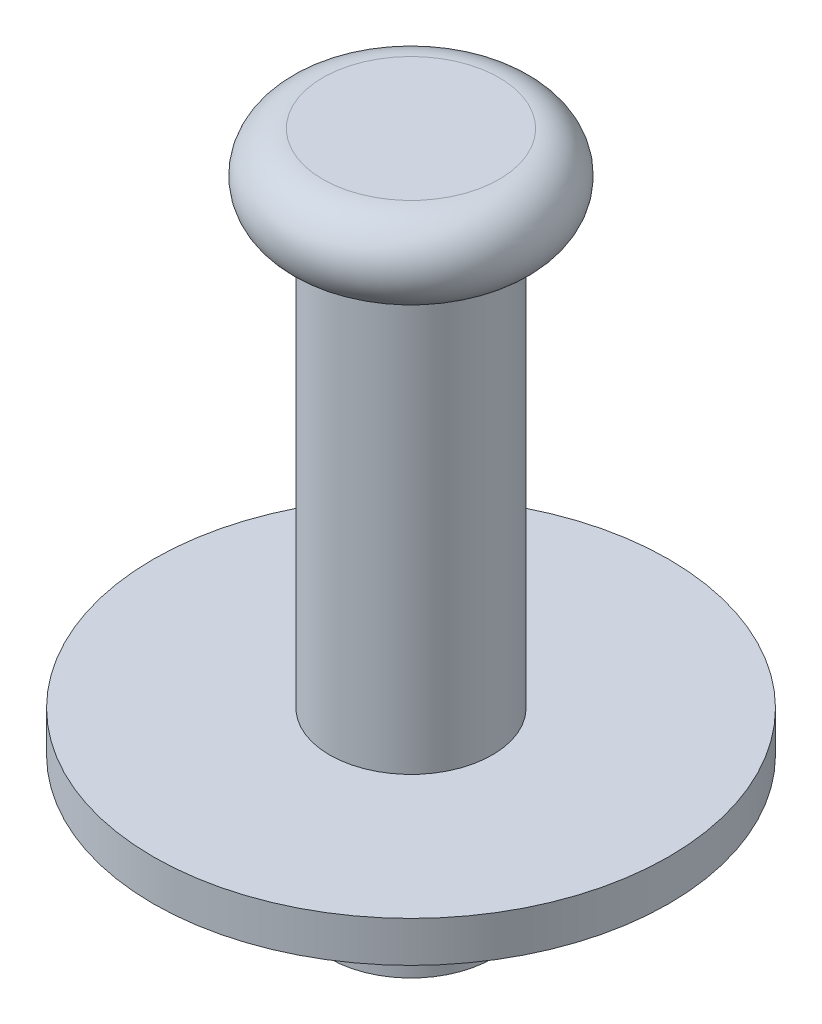
from build123d import *


with BuildPart() as part:
    # Эскиз1 → Повернуть2 (revolve)
    with BuildSketch(Plane.XY, mode=Mode.PRIVATE) as revolve_2_sk:
        with BuildLine():
            Line((3, 12.30781391), (3, -3.19218609))
            Line((3, -3.19218609), (9.5, -3.19218609))
            Line((9.5, -3.19218609), (9.5, -4.69218609))
            Line((9.5, -4.69218609), (3, -4.69218609))
            Line((3, -4.69218609), (3, -9.69218609))
            Line((3, -9.69218609), (0, -9.69218609))
            Line((0, -9.69218609), (0, 15.30781391))
            Line((0, 15.30781391), (3.25, 15.30781391))
            ThreePointArc((3.25, 15.30781391), (4.75, 13.80781391), (3.25, 12.30781391))
            Line((3.25, 12.30781391), (3, 12.30781391))
        make_face()
    revolve(revolve_2_sk.sketch.rotate(Axis((0, 15.673981191, 0), (0, -1, 0)), 90), axis=Axis((0, 15.673981191, 0), (0, -1, 0)))


solid = part.part
